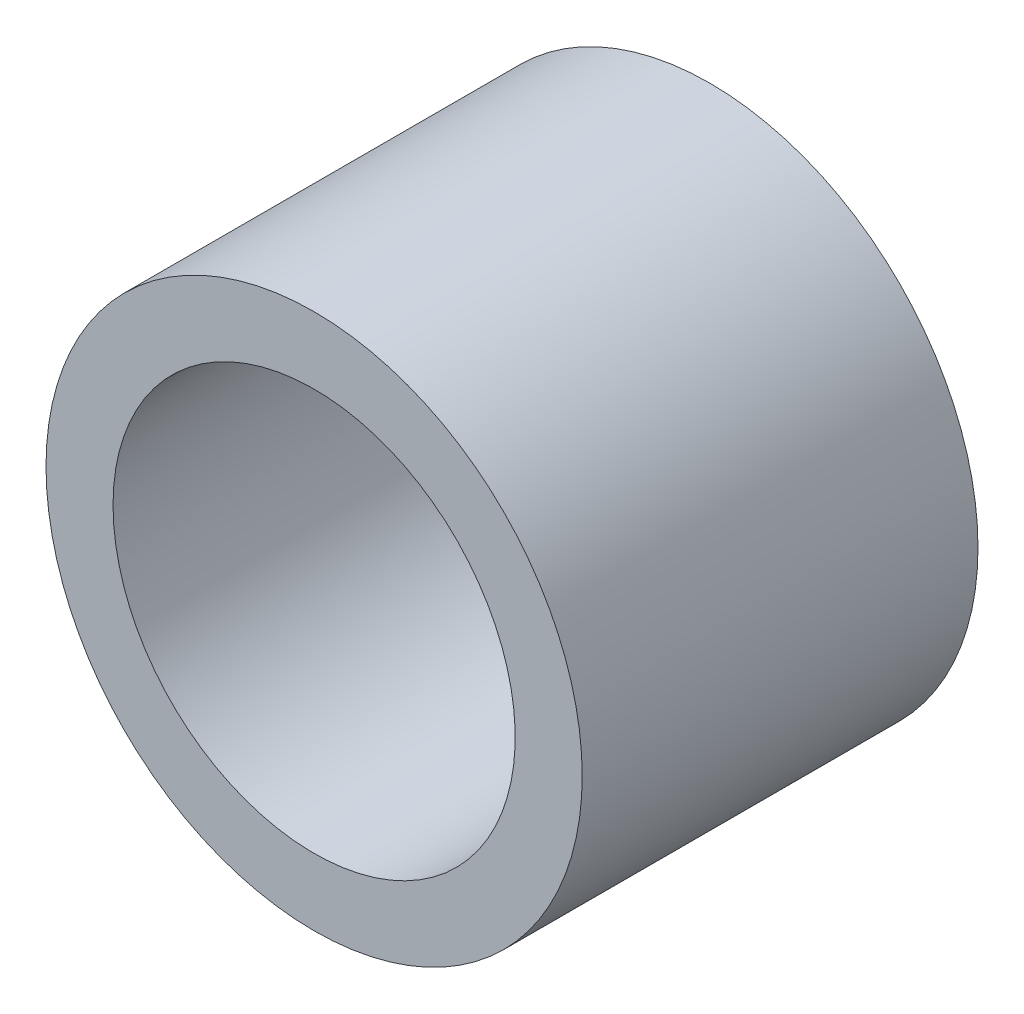
from build123d import *

# Parameters (mm, degrees)
SKETCH1_R           = 4.2
SKETCH1_R_2         = 3.15
BOSS_EXTRUDE1_DEPTH = 6.2


with BuildPart() as part:
    # Sketch1 → Boss-Extrude1 (new body)
    with BuildSketch(Plane.XY):
        with Locations(Location((0, 0, 0), (0, 0, 180))):
            Circle(SKETCH1_R)
        with Locations(Location((0, 0, 0), (0, 0, 180))):
            Circle(SKETCH1_R_2, mode=Mode.SUBTRACT)
    extrude(amount=BOSS_EXTRUDE1_DEPTH)


solid = part.part
